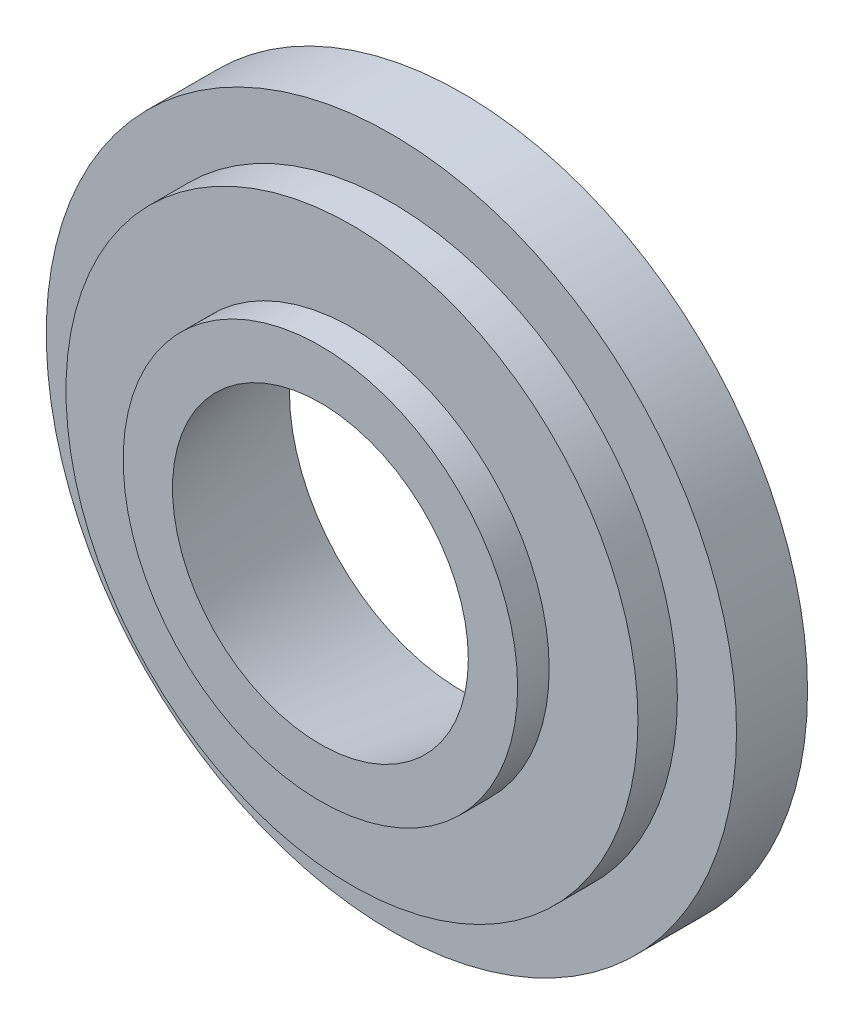
from build123d import *

# Parameters (mm, degrees)
SKETCH_1_R          = 87.5
EXTRUDE_1_DEPTH     = 18
SKETCH_2_R          = 72.5
EXTRUDE_2_DEPTH     = 10
SKETCH_3_R          = 50
EXTRUDE_3_DEPTH     = 8
SKETCH_4_R          = 60.5
SKETCH_4_R_2        = 51.5
CUT_EXTRUDE_1_DEPTH = 5
SKETCH_5_R          = 37.5
CUT_EXTRUDE_2_DEPTH = 129.873969443
CUT_EXTRUDE_2_DRAFT = 10


with BuildPart() as part:
    # 草图1 → 凸台-拉伸1 (new body)
    with BuildSketch(Plane.XY):
        Circle(SKETCH_1_R)
    extrude(amount=EXTRUDE_1_DEPTH)

    # 草图2 → 凸台-拉伸2 (add)
    with BuildSketch(Plane.XY.offset(18)):
        Circle(SKETCH_2_R)
    extrude(amount=EXTRUDE_2_DEPTH)

    # 草图3 → 凸台-拉伸3 (add)
    with BuildSketch(Plane.XY.offset(28)):
        Circle(SKETCH_3_R)
    extrude(amount=EXTRUDE_3_DEPTH)

    # 草图4 → 切除-拉伸1 (cut)
    with BuildSketch(Plane(origin=(0, 0, 0), x_dir=(-1, 0, 0), z_dir=(0, 0, -1))):
        Circle(SKETCH_4_R)
        Circle(SKETCH_4_R_2, mode=Mode.SUBTRACT)
    extrude(amount=-CUT_EXTRUDE_1_DEPTH, mode=Mode.SUBTRACT)


with BuildPart() as cut_extrude_2_tool:
    # 草图5 → 切除-拉伸2 (with draft: the straight prism first)
    with BuildSketch(Plane.XY.offset(36)):
        Circle(SKETCH_5_R)
    extrude(amount=-CUT_EXTRUDE_2_DEPTH)
    # 切除-拉伸2: the draft: its side faces are tilted about the plane it starts from
    cut_extrude_2_sides = [cut_extrude_2_tool.faces().sort_by_distance(p)[0] for p in [
        (-37.5, 0, -28.936984722),
    ]]
    draft(cut_extrude_2_sides, Plane.XY.offset(36), CUT_EXTRUDE_2_DRAFT)


with BuildPart() as part_1:
    add(part.part)

    # 切除-拉伸2: cut by cut_extrude_2_tool
    add(cut_extrude_2_tool.part, mode=Mode.SUBTRACT)


solid = part_1.part
